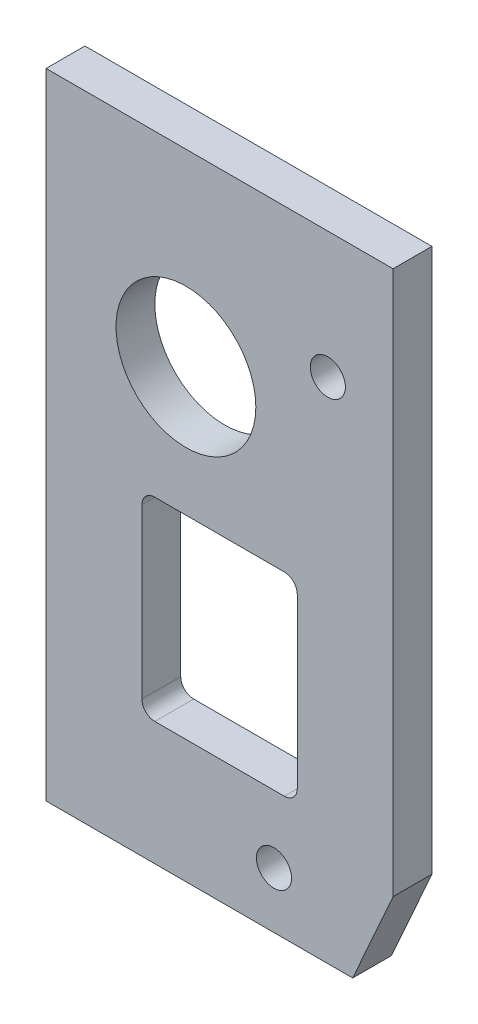
from build123d import *

# Parameters (mm, degrees)
SKETCH1_W             = 19.05
SKETCH1_H             = 23.8125
BOSS_EXTRUDE1_DEPTH   = 4.7625
SKETCH6_R             = 8.5725
CUT_EXTRUDE4_DEPTH    = 471.813362653
F_6_CLEARANCE_HOLE1_D = 4.3053
FILLET1_R             = 1.5875


with BuildPart() as part:
    # Sketch1 → Boss-Extrude1 (new body)
    with BuildSketch(Plane.XY):
        Polygon((1.5875, -17.78), (1.5875, -95.5675), (39.1795, -95.5675), (44.1325, -84.455), (44.1325, -17.78), align=None)
        with Locations((22.86, -68.54825)):
            Rectangle(SKETCH1_W, SKETCH1_H, mode=Mode.SUBTRACT)
    extrude(amount=BOSS_EXTRUDE1_DEPTH)

    # Sketch6 → Cut-Extrude4 (cut, through all)
    with BuildSketch(Plane(origin=(156.406140968, -462.385138809, 4.7625), x_dir=(1, 0, 0), z_dir=(0, 0, 1))):
        with Locations((-137.673640968, 421.491138809)):
            Circle(SKETCH6_R)
    extrude(amount=-CUT_EXTRUDE4_DEPTH, mode=Mode.SUBTRACT)

    # #6 Clearance Hole1 (through all)
    with Locations(Plane.XY.offset(4.7625)):
        with Locations((36.1315, -33.274), (29.5275, -88.7095)):
            Hole(F_6_CLEARANCE_HOLE1_D / 2)

    # Fillet1
    fillet1_edges = [part.edges().sort_by_distance(p)[0] for p in [
        (13.335, -80.4545, 2.38125),
        (32.385, -80.4545, 2.38125),
        (32.385, -56.642, 2.38125),
        (13.335, -56.642, 2.38125),
    ]]
    fillet(fillet1_edges, radius=FILLET1_R)


solid = part.part
